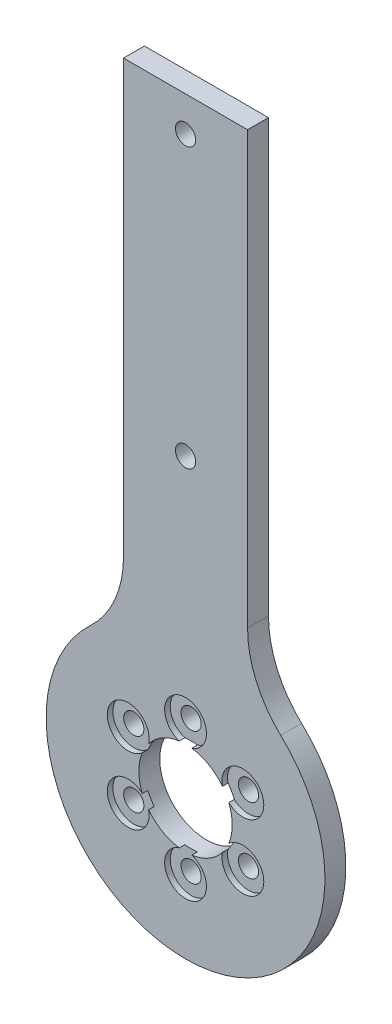
from build123d import *

# Parameters (mm, degrees)
SKETCH_1_R          = 20
SKETCH_1_R_2        = 6.7
SKETCH_1_R_3        = 1.45
EXTRUDE_1_DEPTH     = 3
SKETCH_2_W          = 17.8
SKETCH_2_H          = 75
SKETCH_2_R          = 1.45
EXTRUDE_2_DEPTH     = 3
FILLET_1_R          = 15
SKETCH_3_R          = 3
CUT_EXTRUDE_1_DEPTH = 0.8


with BuildPart() as part:
    # 草图1 → 凸台-拉伸1 (new body)
    with BuildSketch(Plane.XY):
        Circle(SKETCH_1_R)
        Circle(SKETCH_1_R_2, mode=Mode.SUBTRACT)
        with Locations((0, 9.5)):
            Circle(SKETCH_1_R_3, mode=Mode.SUBTRACT)
        with Locations((8.227241336, 4.75)):
            Circle(SKETCH_1_R_3, mode=Mode.SUBTRACT)
        with Locations((8.227241336, -4.75)):
            Circle(SKETCH_1_R_3, mode=Mode.SUBTRACT)
        with Locations((0, -9.5)):
            Circle(SKETCH_1_R_3, mode=Mode.SUBTRACT)
        with Locations((-8.227241336, -4.75)):
            Circle(SKETCH_1_R_3, mode=Mode.SUBTRACT)
        with Locations((-8.227241336, 4.75)):
            Circle(SKETCH_1_R_3, mode=Mode.SUBTRACT)
    extrude(amount=EXTRUDE_1_DEPTH)

    # 草图2 → 凸台-拉伸2 (add)
    with BuildSketch(Plane.XY):
        with Locations((0, 50)):
            Rectangle(SKETCH_2_W, SKETCH_2_H)
        with Locations((0, 42.5)):
            Circle(SKETCH_2_R, mode=Mode.SUBTRACT)
        with Locations((0, 82.5)):
            Circle(SKETCH_2_R, mode=Mode.SUBTRACT)
    extrude(amount=EXTRUDE_2_DEPTH)

    # 圆角1
    fillet_1_edges = [part.edges().sort_by_distance(p)[0] for p in [
        (-8.9, 17.91061138, 1.5),
        (8.9, 17.91061138, 1.5),
    ]]
    fillet(fillet_1_edges, radius=FILLET_1_R)

    # 草图3 → 切除-拉伸1 (cut)
    with BuildSketch(Plane.XY.offset(3)):
        with Locations((0, 9.5)):
            Circle(SKETCH_3_R)
        with Locations((8.227241336, 4.75)):
            Circle(SKETCH_3_R)
        with Locations((8.227241336, -4.75)):
            Circle(SKETCH_3_R)
        with Locations((0, -9.5)):
            Circle(SKETCH_3_R)
        with Locations((-8.227241336, -4.75)):
            Circle(SKETCH_3_R)
        with Locations((-8.227241336, 4.75)):
            Circle(SKETCH_3_R)
    extrude(amount=-CUT_EXTRUDE_1_DEPTH, mode=Mode.SUBTRACT)


solid = part.part
